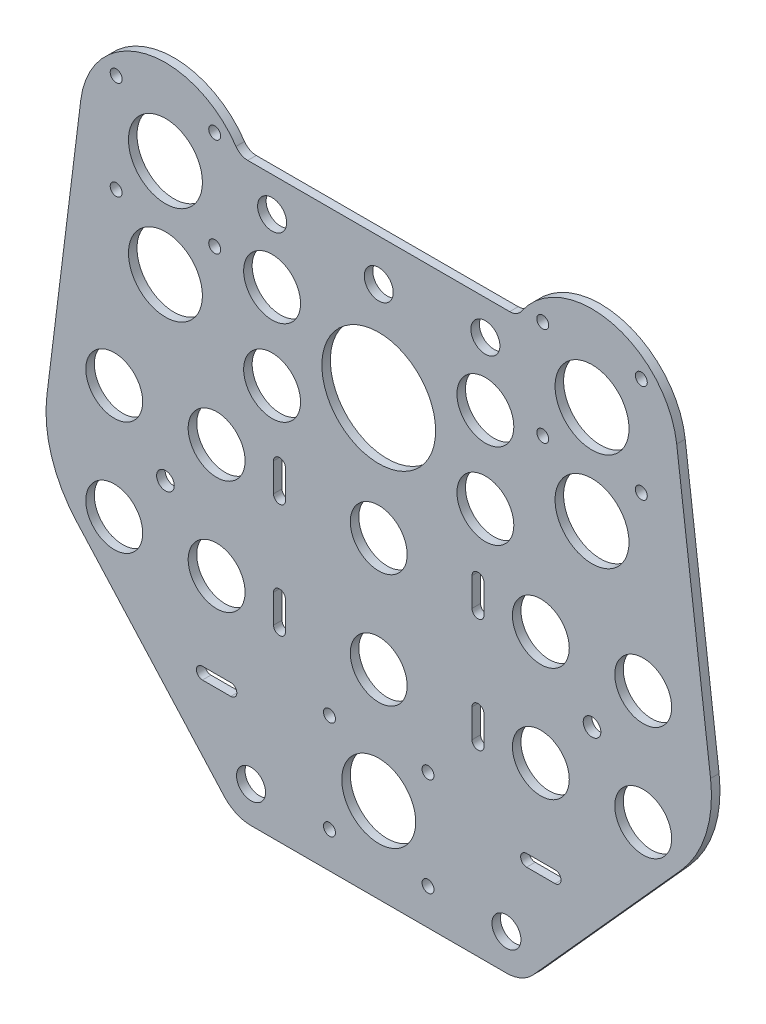
from build123d import *

# Parameters (mm, degrees)
MODEL_R             = 2.1
MODEL_R_2           = 13
MODEL_R_3           = 3.1
MODEL_R_4           = 10
MODEL_R_5           = 5.1
MODEL_R_6           = 20
BOSS_EXTRUDE1_DEPTH = 3


with BuildPart() as part:
    # Model → Boss-Extrude1 (new body)
    with BuildSketch(Plane.XY):
        with BuildLine():
            Line((-44.9, -112.113099849), (0, -112.113099849))
            Line((0, -112.113099849), (44.9, -112.113099849))
            ThreePointArc((44.9, -112.113099849), (50.059264201, -111.015645267), (54.325169295, -107.913312696))
            Line((54.325169295, -107.913312696), (106.229152519, -50.197615742))
            ThreePointArc((106.229152519, -50.197615742), (115.069026633, -34.701709967), (116.679519982, -16.934527261))
            Line((116.679519982, -16.934527261), (104.771085702, 78.90999671))
            ThreePointArc((104.771085702, 78.90999671), (82.034748438, 104.374560561), (50.189310486, 92.0760596))
            ThreePointArc((50.189310486, 92.0760596), (48.393618278, 90.467952157), (46.054195567, 89.886900151))
            Line((46.054195567, 89.886900151), (0, 89.886900151))
            Line((0, 89.886900151), (-46.054195567, 89.886900151))
            ThreePointArc((-46.054195567, 89.886900151), (-48.393618278, 90.467952157), (-50.189310486, 92.0760596))
            ThreePointArc((-50.189310486, 92.0760596), (-82.034748438, 104.374560561), (-104.771085702, 78.90999671))
            Line((-104.771085702, 78.90999671), (-116.679519982, -16.934527261))
            ThreePointArc((-116.679519982, -16.934527261), (-115.069026633, -34.701709967), (-106.229152519, -50.197615742))
            Line((-106.229152519, -50.197615742), (-54.325169295, -107.913312696))
            ThreePointArc((-54.325169295, -107.913312696), (-50.059264201, -111.015645267), (-44.9, -112.113099849))
        make_face()
        with Locations((17.324116139, -99.437215988)):
            Circle(MODEL_R, mode=Mode.SUBTRACT)
        with Locations((-17.324116139, -64.78898371)):
            Circle(MODEL_R, mode=Mode.SUBTRACT)
        with Locations((-92.324116139, 57.886900151)):
            Circle(MODEL_R, mode=Mode.SUBTRACT)
        with Locations((-57.675883861, 92.535132429)):
            Circle(MODEL_R, mode=Mode.SUBTRACT)
        with Locations((0, -82.113099849)):
            Circle(MODEL_R_2, mode=Mode.SUBTRACT)
        with Locations((-75, 75.21101629)):
            Circle(MODEL_R_2, mode=Mode.SUBTRACT)
        with Locations((-92.324116139, 92.535132429)):
            Circle(MODEL_R, mode=Mode.SUBTRACT)
        with Locations((-57.675883861, 57.886900151)):
            Circle(MODEL_R, mode=Mode.SUBTRACT)
        with Locations((17.324116139, -64.78898371)):
            Circle(MODEL_R, mode=Mode.SUBTRACT)
        with Locations((-17.324116139, -99.437215988)):
            Circle(MODEL_R, mode=Mode.SUBTRACT)
        with Locations((-75, -22.113099849)):
            Circle(MODEL_R_3, mode=Mode.SUBTRACT)
        with Locations((-57, -2.113099849)):
            Circle(MODEL_R_4, mode=Mode.SUBTRACT)
        with Locations((-57, -42.113099849)):
            Circle(MODEL_R_4, mode=Mode.SUBTRACT)
        with Locations((-93, -2.113099849)):
            Circle(MODEL_R_4, mode=Mode.SUBTRACT)
        with Locations((-93, -42.113099849)):
            Circle(MODEL_R_4, mode=Mode.SUBTRACT)
        with Locations((-44.9, -99.437215988)):
            Circle(MODEL_R_5, mode=Mode.SUBTRACT)
        with Locations((75, -22.113099849)):
            Circle(MODEL_R_3, mode=Mode.SUBTRACT)
        with Locations((57, -2.113099849)):
            Circle(MODEL_R_4, mode=Mode.SUBTRACT)
        with Locations((57, -42.113099849)):
            Circle(MODEL_R_4, mode=Mode.SUBTRACT)
        with Locations((93, -2.113099849)):
            Circle(MODEL_R_4, mode=Mode.SUBTRACT)
        with Locations((93, -42.113099849)):
            Circle(MODEL_R_4, mode=Mode.SUBTRACT)
        with Locations((44.9, -99.437215988)):
            Circle(MODEL_R_5, mode=Mode.SUBTRACT)
        with Locations((0, 75.21101629)):
            Circle(MODEL_R_5, mode=Mode.SUBTRACT)
        with Locations((0, -2.113099849)):
            Circle(MODEL_R_4, mode=Mode.SUBTRACT)
        with Locations((0, -42.113099849)):
            Circle(MODEL_R_4, mode=Mode.SUBTRACT)
        with Locations((0, 40.562784012)):
            Circle(MODEL_R_6, mode=Mode.SUBTRACT)
        with Locations((-37.5, 55.562784012)):
            Circle(MODEL_R_4, mode=Mode.SUBTRACT)
        with Locations((-37.5, 25.562784012)):
            Circle(MODEL_R_4, mode=Mode.SUBTRACT)
        with Locations((37.5, 55.562784012)):
            Circle(MODEL_R_4, mode=Mode.SUBTRACT)
        with Locations((37.5, 25.562784012)):
            Circle(MODEL_R_4, mode=Mode.SUBTRACT)
        with Locations((57.675883861, 57.886900151)):
            Circle(MODEL_R, mode=Mode.SUBTRACT)
        with Locations((92.324116139, 92.535132429)):
            Circle(MODEL_R, mode=Mode.SUBTRACT)
        with Locations((75, 75.21101629)):
            Circle(MODEL_R_2, mode=Mode.SUBTRACT)
        with Locations((57.675883861, 92.535132429)):
            Circle(MODEL_R, mode=Mode.SUBTRACT)
        with Locations((92.324116139, 57.886900151)):
            Circle(MODEL_R, mode=Mode.SUBTRACT)
        with Locations((-75, 40.688174024)):
            Circle(MODEL_R_2, mode=Mode.SUBTRACT)
        with Locations((75, 40.562784012)):
            Circle(MODEL_R_2, mode=Mode.SUBTRACT)
        with Locations((-37.5, 77.724842082)):
            Circle(MODEL_R_5, mode=Mode.SUBTRACT)
        with Locations((37.5, 77.724842082)):
            Circle(MODEL_R_5, mode=Mode.SUBTRACT)
        with BuildLine():
            Line((-37, 2.886900151), (-37, -7.113099849))
            ThreePointArc((-37, -7.113099849), (-34.9, -9.213099849), (-32.8, -7.113099849))
            Line((-32.8, -7.113099849), (-32.8, 2.886900151))
            ThreePointArc((-32.8, 2.886900151), (-34.9, 4.986900151), (-37, 2.886900151))
        make_face(mode=Mode.SUBTRACT)
        with BuildLine():
            Line((-37, -37.113099849), (-37, -47.113099849))
            ThreePointArc((-37, -47.113099849), (-34.9, -49.213099849), (-32.8, -47.113099849))
            Line((-32.8, -47.113099849), (-32.8, -37.113099849))
            ThreePointArc((-32.8, -37.113099849), (-34.9, -35.013099849), (-37, -37.113099849))
        make_face(mode=Mode.SUBTRACT)
        with BuildLine():
            Line((37, 2.886900151), (37, -7.113099849))
            ThreePointArc((37, -7.113099849), (34.9, -9.213099849), (32.8, -7.113099849))
            Line((32.8, -7.113099849), (32.8, 2.886900151))
            ThreePointArc((32.8, 2.886900151), (34.9, 4.986900151), (37, 2.886900151))
        make_face(mode=Mode.SUBTRACT)
        with BuildLine():
            Line((37, -37.113099849), (37, -47.113099849))
            ThreePointArc((37, -47.113099849), (34.9, -49.213099849), (32.8, -47.113099849))
            Line((32.8, -47.113099849), (32.8, -37.113099849))
            ThreePointArc((32.8, -37.113099849), (34.9, -35.013099849), (37, -37.113099849))
        make_face(mode=Mode.SUBTRACT)
        with BuildLine():
            Line((-62, -72.113099849), (-52, -72.113099849))
            ThreePointArc((-52, -72.113099849), (-49.9, -74.213099849), (-52, -76.313099849))
            Line((-52, -76.313099849), (-62, -76.313099849))
            ThreePointArc((-62, -76.313099849), (-64.1, -74.213099849), (-62, -72.113099849))
        make_face(mode=Mode.SUBTRACT)
        with BuildLine():
            Line((62, -72.113099849), (52, -72.113099849))
            ThreePointArc((52, -72.113099849), (49.9, -74.213099849), (52, -76.313099849))
            Line((52, -76.313099849), (62, -76.313099849))
            ThreePointArc((62, -76.313099849), (64.1, -74.213099849), (62, -72.113099849))
        make_face(mode=Mode.SUBTRACT)
    extrude(amount=BOSS_EXTRUDE1_DEPTH)


solid = part.part
